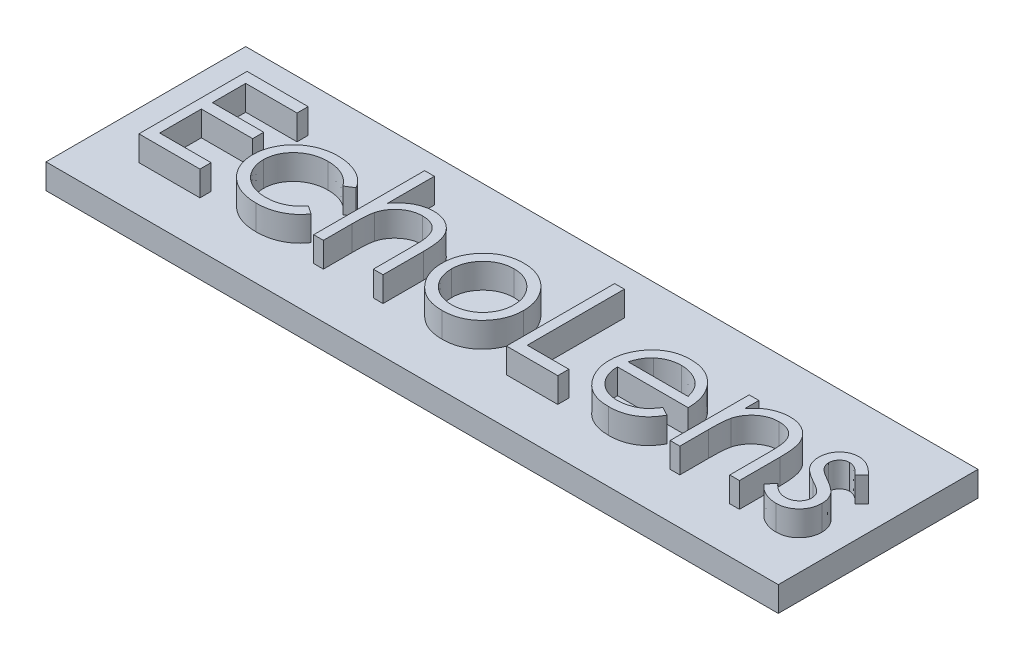
from build123d import *

# Parameters (mm, degrees)
SKETCH1_W           = 44
SKETCH1_H           = 12
BOSS_EXTRUDE1_DEPTH = 1.5
BOSS_EXTRUDE2_DEPTH = 1.5


with BuildPart() as part:
    # Sketch1 → Boss-Extrude1 (new body)
    with BuildSketch(Plane(origin=(0, 0, 0), x_dir=(1, 0, 0), z_dir=(0, 1, 0))):
        with Locations((0, 3.25)):
            Rectangle(SKETCH1_W, SKETCH1_H)
    extrude(amount=-BOSS_EXTRUDE1_DEPTH)

    # Sketch1<3> → Boss-Extrude2 (add)
    # profile 1 of 8: a face of its own
    with BuildSketch(Plane(origin=(0, 0, 0), x_dir=(1, 0, 0), z_dir=(0, 1, 0))):
        Polygon((-19.166666667, 6.5), (-19.166666667, 0), (-15.5, 0), (-15.5, 0.666666667), (-18.583333333, 0.666666667), (-18.583333333, 3.166666667), (-15.5, 3.166666667), (-15.5, 3.833333333), (-18.583333333, 3.833333333), (-18.583333333, 5.833333333), (-15.5, 5.833333333), (-15.5, 6.5), align=None)
    # profile 2 of 8: a face of its own
    with BuildSketch(Plane(origin=(0, 0, 0), x_dir=(1, 0, 0), z_dir=(0, 1, 0))):
        with BuildLine():
            add(Edge.make_bspline(
                [(17.833333333, 0.559895833), (17.91183066, 0.460355015), (18.0480398, 0.324779174), (18.258344258, 0.176966096), (18.431067874, 0.083741455), (18.613801438, 0.010099076), (18.865554121, -0.061803994), (19.060923375, -0.084323226), (19.19140625, -0.083333333)],
                knots=[0.350515196, 0.350515196, 0.350515196, 0.350515196, 0.595114129, 0.719056958, 0.845821647, 0.973296508, 1.098791235, 1.350515196, 1.350515196, 1.350515196, 1.350515196], degree=3))
            add(Edge.make_bspline(
                [(19.19140625, -0.083333333), (19.286843867, -0.08268315), (19.42853365, -0.072024247), (19.610519169, -0.029957184), (19.738593085, 0.014704012), (19.860286094, 0.070920807), (19.975872396, 0.138841981), (20.084526667, 0.22060146), (20.186382628, 0.313617655), (20.279409281, 0.415461478), (20.360891939, 0.523873955), (20.428763948, 0.63871253), (20.486686981, 0.757494075), (20.529541208, 0.883211445), (20.572246332, 1.059143612), (20.582456943, 1.196710606), (20.583333333, 1.2890625)],
                knots=[0.765180635, 0.765180635, 0.765180635, 0.765180635, 0.896540935, 0.959682152, 1.021612153, 1.082783528, 1.143809055, 1.205661307, 1.26947635, 1.333291392, 1.395143644, 1.455655936, 1.51654112, 1.576583297, 1.637981503, 1.765180635, 1.765180635, 1.765180635, 1.765180635], degree=3))
            add(Edge.make_bspline(
                [(20.361979167, 2.0234375), (20.432651307, 1.916588213), (20.551651176, 1.68137894), (20.581474324, 1.419515505), (20.583333333, 1.2890625)],
                knots=[0, 0, 0, 0, 0.495235025, 1, 1, 1, 1], degree=3))
            add(Edge.make_bspline(
                [(19.506510417, 2.690104167), (19.604418856, 2.636005318), (19.745289238, 2.554517104), (19.919274341, 2.437830938), (20.033423488, 2.354895977), (20.133557995, 2.271008369), (20.248135384, 2.166632696), (20.320816278, 2.081559281), (20.361979167, 2.0234375)],
                knots=[0, 0, 0, 0, 0.307114592, 0.446213159, 0.574876072, 0.69415211, 0.80458118, 1, 1, 1, 1], degree=3))
            add(Edge.make_bspline(
                [(18.828125, 3.1796875), (18.857806805, 3.139360593), (18.915766464, 3.08450984), (19.000408876, 3.009882962), (19.080798182, 2.950512124), (19.171367905, 2.888093733), (19.314083238, 2.80004431), (19.425869397, 2.732096268), (19.506510417, 2.690104167)],
                knots=[0, 0, 0, 0, 0.177559821, 0.28398236, 0.402216747, 0.53356848, 0.676120994, 1, 1, 1, 1], degree=3))
            add(Edge.make_bspline(
                [(18.666666667, 3.610677083), (18.66680691, 3.535712522), (18.69593832, 3.37944539), (18.778557506, 3.243812882), (18.828125, 3.1796875)],
                knots=[0, 0, 0, 0, 0.479403194, 1, 1, 1, 1], degree=3))
            add(Edge.make_bspline(
                [(19.283854167, 4.25), (19.202790293, 4.251661666), (19.08187837, 4.225488948), (18.938279167, 4.144579699), (18.845102024, 4.059333224), (18.766290259, 3.961312214), (18.688870494, 3.814869332), (18.666896009, 3.69228858), (18.666666667, 3.610677083)],
                knots=[0, 0, 0, 0, 0.245900629, 0.36916603, 0.498510841, 0.628503866, 0.751028329, 1, 1, 1, 1], degree=3))
            add(Edge.make_bspline(
                [(20.104166667, 3.75), (20.039505928, 3.827125335), (19.940206361, 3.934736043), (19.79567965, 4.053583252), (19.693465064, 4.125959487), (19.590465283, 4.180567938), (19.456634168, 4.233024102), (19.352224646, 4.249939149), (19.283854167, 4.25)],
                knots=[0, 0, 0, 0, 0.305035505, 0.441308964, 0.565963227, 0.683525114, 0.79333413, 1, 1, 1, 1], degree=3))
            Line((20.104166667, 3.75), (20.5, 4.157552083))
            add(Edge.make_bspline(
                [(19.283854167, 4.833333333), (19.385802566, 4.833234555), (19.541584834, 4.811522199), (19.741961467, 4.740076862), (19.894857727, 4.66546072), (20.046750564, 4.568700277), (20.257548697, 4.407355971), (20.406013609, 4.263956281), (20.5, 4.157552083)],
                knots=[0, 0, 0, 0, 0.213411613, 0.32612673, 0.444451672, 0.56906108, 0.702712204, 1, 1, 1, 1], degree=3))
            add(Edge.make_bspline(
                [(18.083333333, 3.587239583), (18.083921656, 3.67293245), (18.091588778, 3.800397203), (18.129996663, 3.963036276), (18.165358728, 4.078411359), (18.214548167, 4.187058988), (18.273317339, 4.290422632), (18.342380187, 4.388360811), (18.421946165, 4.479366681), (18.509429973, 4.562026598), (18.603948814, 4.634082151), (18.703377037, 4.695561875), (18.808135418, 4.747138801), (18.919231005, 4.786091835), (19.077416871, 4.822757633), (19.200444195, 4.834326094), (19.283854167, 4.833333333)],
                knots=[0, 0, 0, 0, 0.133043535, 0.196507438, 0.258613417, 0.319728338, 0.380872854, 0.442635602, 0.505079304, 0.56788052, 0.628813854, 0.688910091, 0.748765006, 0.809385783, 0.870884336, 1, 1, 1, 1], degree=3))
            add(Edge.make_bspline(
                [(18.30078125, 2.85546875), (18.227853533, 2.960201938), (18.119444929, 3.197727702), (18.080971468, 3.455904158), (18.083333333, 3.587239583)],
                knots=[0, 0, 0, 0, 0.492590796, 1, 1, 1, 1], degree=3))
            add(Edge.make_bspline(
                [(19.119791667, 2.20703125), (19.025830979, 2.258970114), (18.890284361, 2.336388916), (18.724868371, 2.450916827), (18.615091825, 2.530593062), (18.518274814, 2.611273959), (18.410720749, 2.715952529), (18.339668112, 2.797772412), (18.30078125, 2.85546875)],
                knots=[0, 0, 0, 0, 0.305950213, 0.443775499, 0.572824362, 0.692154156, 0.802295707, 1, 1, 1, 1], degree=3))
            add(Edge.make_bspline(
                [(19.83984375, 1.717447917), (19.808556469, 1.755087057), (19.750614644, 1.809702192), (19.66164666, 1.880439678), (19.577857698, 1.940524945), (19.481287293, 2.002900276), (19.327782958, 2.093166501), (19.205907181, 2.161611102), (19.119791667, 2.20703125)],
                knots=[0, 0, 0, 0, 0.167461676, 0.272270023, 0.389550841, 0.520801368, 0.666263293, 1, 1, 1, 1], degree=3))
            add(Edge.make_bspline(
                [(20, 1.264322917), (19.999689205, 1.345980779), (19.973704927, 1.509948366), (19.891638576, 1.6543966), (19.83984375, 1.717447917)],
                knots=[0, 0, 0, 0, 0.500453315, 1, 1, 1, 1], degree=3))
            add(Edge.make_bspline(
                [(19.161458333, 0.5), (19.271416434, 0.499048344), (19.434510065, 0.527438909), (19.630818421, 0.623588312), (19.757187173, 0.723910884), (19.86457304, 0.840859363), (19.968826893, 1.016027504), (20.000615188, 1.165488446), (20, 1.264322917)],
                knots=[0, 0, 0, 0, 0.261895674, 0.387836045, 0.517686206, 0.644508654, 0.764718263, 1, 1, 1, 1], degree=3))
            add(Edge.make_bspline(
                [(18.220052083, 1), (18.289973365, 0.922194824), (18.398232432, 0.813200055), (18.557669739, 0.695297675), (18.674340888, 0.623494147), (18.793613613, 0.568276989), (18.954185407, 0.516430618), (19.078896852, 0.499600367), (19.161458333, 0.5)],
                knots=[0, 0, 0, 0, 0.285904172, 0.417171648, 0.540500744, 0.659237718, 0.775006098, 1, 1, 1, 1], degree=3))
            Line((18.220052083, 1), (17.833333333, 0.559895833))
        make_face()
    # profile 3 of 8: a face of its own
    with BuildSketch(Plane(origin=(0, 0, 0), x_dir=(1, 0, 0), z_dir=(0, 1, 0))):
        with BuildLine():
            Line((12.75, 4.75), (12.75, 0))
            Line((12.75, 0), (13.333333333, 0))
            Line((13.333333333, 0), (13.333333333, 1.717447917))
            add(Edge.make_bspline(
                [(13.423177083, 2.9921875), (13.405802929, 2.9227345), (13.386418444, 2.808565672), (13.367154902, 2.643457372), (13.354035699, 2.493239674), (13.346051414, 2.324686359), (13.333883023, 2.064390259), (13.334203249, 1.859785879), (13.333333333, 1.717447917)],
                knots=[0, 0, 0, 0, 0.167615077, 0.271052394, 0.389459503, 0.520842802, 0.666398759, 1, 1, 1, 1], degree=3))
            add(Edge.make_bspline(
                [(15.0390625, 4.25), (14.946251525, 4.250444136), (14.807460208, 4.239868004), (14.627990648, 4.201070732), (14.497211345, 4.162358965), (14.371839436, 4.109117079), (14.247848685, 4.048708631), (14.129907546, 3.973403915), (14.01550118, 3.889478736), (13.909063342, 3.796474368), (13.810024154, 3.698334798), (13.721742348, 3.593822162), (13.641746323, 3.484625184), (13.572742802, 3.369226705), (13.491917097, 3.208152857), (13.446557215, 3.079950218), (13.423177083, 2.9921875)],
                knots=[0, 0, 0, 0, 0.126626858, 0.188984372, 0.250230194, 0.312351163, 0.374573618, 0.438147531, 0.502920413, 0.567974095, 0.630771334, 0.692934609, 0.754397534, 0.815218352, 0.876116925, 1, 1, 1, 1], degree=3))
            add(Edge.make_bspline(
                [(16.264322917, 3.315104167), (16.2317815, 3.457745072), (16.158097518, 3.661331633), (15.994174913, 3.887118341), (15.849599912, 4.021196413), (15.680155292, 4.125420764), (15.411945439, 4.226122324), (15.190700752, 4.25086197), (15.0390625, 4.25)],
                knots=[0, 0, 0, 0, 0.260833163, 0.378476029, 0.493177646, 0.609280965, 0.729981038, 1, 1, 1, 1], degree=3))
            add(Edge.make_bspline(
                [(16.333333333, 2.234375), (16.332414843, 2.358066375), (16.332208015, 2.53522146), (16.324905134, 2.760479809), (16.317580817, 2.904220143), (16.306813315, 3.030932352), (16.293160102, 3.166497337), (16.277439239, 3.25928602), (16.264322917, 3.315104167)],
                knots=[0, 0, 0, 0, 0.342109649, 0.489825663, 0.623254428, 0.740079676, 0.841482673, 1, 1, 1, 1], degree=3))
            Line((16.333333333, 2.234375), (16.333333333, 0))
            Line((16.333333333, 0), (16.916666667, 0))
            Line((16.916666667, 0), (16.916666667, 2.42578125))
            add(Edge.make_bspline(
                [(15.140625, 4.833333333), (15.31217977, 4.832197179), (15.568235459, 4.804335442), (15.885011659, 4.68779637), (16.101581369, 4.570503901), (16.296820124, 4.424493645), (16.46827991, 4.254427655), (16.61009753, 4.058801614), (16.705178352, 3.87731622), (16.767811596, 3.716322678), (16.807243466, 3.578435872), (16.840727915, 3.424816444), (16.869765406, 3.255928637), (16.889378626, 3.070589139), (16.910982338, 2.792525495), (16.91811515, 2.575627984), (16.916666667, 2.42578125)],
                knots=[0, 0, 0, 0, 0.15117814, 0.223487984, 0.295542644, 0.366976255, 0.437130525, 0.507043616, 0.578559734, 0.616613545, 0.658756237, 0.704491226, 0.754803115, 0.809331625, 0.868274455, 1, 1, 1, 1], degree=3))
            add(Edge.make_bspline(
                [(13.333333333, 3.893229167), (13.45099597, 4.045899796), (13.638371986, 4.259323773), (13.930535916, 4.483222438), (14.153342073, 4.613473968), (14.386652113, 4.711514848), (14.712584266, 4.807325961), (14.968932741, 4.832448887), (15.140625, 4.833333333)],
                knots=[0, 0, 0, 0, 0.273568781, 0.398988314, 0.519929781, 0.638110022, 0.756588901, 1, 1, 1, 1], degree=3))
            Line((13.333333333, 3.893229167), (13.333333333, 4.75))
            Line((13.333333333, 4.75), (12.75, 4.75))
        make_face()
    # profile 4 of 8: a face of its own
    with BuildSketch(Plane(origin=(0, 0, 0), x_dir=(1, 0, 0), z_dir=(0, 1, 0))):
        with BuildLine():
            add(Edge.make_bspline(
                [(6.75, 2.361979167), (6.751698779, 2.207794263), (6.768003796, 1.977783764), (6.835011895, 1.679810497), (6.906280489, 1.464637514), (6.99460728, 1.254277208), (7.103167047, 1.050059992), (7.233030397, 0.853284747), (7.380197303, 0.664446742), (7.543670902, 0.487988004), (7.727192914, 0.335455298), (7.924980011, 0.205535622), (8.138073557, 0.098865743), (8.366892225, 0.017289492), (8.699751362, -0.062839454), (8.961463082, -0.083261122), (9.139322917, -0.083333333)],
                knots=[0.183293708, 0.183293708, 0.183293708, 0.183293708, 0.304374132, 0.363361986, 0.422483372, 0.481999661, 0.542174786, 0.603662437, 0.666742017, 0.729860193, 0.79199231, 0.853479961, 0.915158744, 0.97849701, 1.043664483, 1.183293708, 1.183293708, 1.183293708, 1.183293708], degree=3))
            add(Edge.make_bspline(
                [(9.139322917, -0.083333333), (9.299582816, -0.083312607), (9.535210568, -0.067240483), (9.836779502, -0.0053499), (10.045334137, 0.058495393), (10.241912368, 0.141622392), (10.428163954, 0.240266544), (10.604092187, 0.356039933), (10.770636312, 0.488355696), (10.928629013, 0.640170473), (11.127242798, 0.881157331), (11.256260352, 1.083578262), (11.333333333, 1.227864583)],
                knots=[0.736737234, 0.736737234, 0.736737234, 0.736737234, 0.914843086, 0.998064997, 1.078293803, 1.156745143, 1.23483405, 1.312137372, 1.39038245, 1.470863007, 1.555076468, 1.736737234, 1.736737234, 1.736737234, 1.736737234], degree=3))
            Line((11.333333333, 1.227864583), (10.815104167, 1.5))
            add(Edge.make_bspline(
                [(9.06640625, 0.5), (9.181909214, 0.499441314), (9.355173646, 0.513041285), (9.581463334, 0.560434795), (9.747233286, 0.608457309), (9.906150507, 0.667115594), (10.053321462, 0.737873689), (10.188668072, 0.816154381), (10.31517965, 0.905680474), (10.437847352, 1.015291507), (10.611486103, 1.209955237), (10.736129676, 1.376411816), (10.815104167, 1.5)],
                knots=[0, 0, 0, 0, 0.163878894, 0.24565874, 0.327725695, 0.408609961, 0.485749086, 0.559169056, 0.630268476, 0.705306028, 0.792064966, 1, 1, 1, 1], degree=3))
            add(Edge.make_bspline(
                [(7.333333333, 2.25), (7.33665525, 2.126971694), (7.353147322, 1.945238643), (7.409382593, 1.712699673), (7.467410443, 1.550974882), (7.537745855, 1.396961566), (7.623887749, 1.251803551), (7.726662022, 1.11616169), (7.841295239, 0.988822629), (7.968894195, 0.875424424), (8.103133549, 0.77392699), (8.245935954, 0.688864137), (8.396175009, 0.619798364), (8.553609234, 0.565809232), (8.776433069, 0.515542949), (8.949385535, 0.499350586), (9.06640625, 0.5)],
                knots=[0, 0, 0, 0, 0.134475588, 0.198391058, 0.260753477, 0.321829223, 0.383037238, 0.444653123, 0.507398011, 0.569825238, 0.630777641, 0.690928687, 0.750945133, 0.811049477, 0.872330853, 1, 1, 1, 1], degree=3))
            Line((7.333333333, 2.25), (11.583333333, 2.25))
            add(Edge.make_bspline(
                [(11.06640625, 3.8984375), (11.151624318, 3.789072542), (11.262883964, 3.611456953), (11.381018248, 3.35742577), (11.452289406, 3.155216836), (11.509879653, 2.943825042), (11.56671098, 2.642306536), (11.58038147, 2.408339334), (11.583333333, 2.25)],
                knots=[0, 0, 0, 0, 0.236254763, 0.356174434, 0.477249655, 0.601539871, 0.729618382, 1, 1, 1, 1], degree=3))
            add(Edge.make_bspline(
                [(9.153645833, 4.833333333), (9.344611194, 4.83413557), (9.626726536, 4.806500902), (9.984399367, 4.707535152), (10.232967437, 4.605233265), (10.466353673, 4.472982878), (10.760293285, 4.25185142), (10.952401555, 4.048234852), (11.06640625, 3.8984375)],
                knots=[0, 0, 0, 0, 0.259032841, 0.381879824, 0.502258444, 0.62275219, 0.744742632, 1, 1, 1, 1], degree=3))
            add(Edge.make_bspline(
                [(7.296875, 3.947916667), (7.409367826, 4.088547972), (7.592794066, 4.285185666), (7.880023777, 4.490887502), (8.105809677, 4.617246658), (8.347872342, 4.713135642), (8.694314961, 4.810625247), (8.968941441, 4.831107399), (9.153645833, 4.833333333)],
                knots=[0, 0, 0, 0, 0.253589335, 0.374643257, 0.495340042, 0.616324775, 0.739759335, 1, 1, 1, 1], degree=3))
            add(Edge.make_bspline(
                [(6.75, 2.361979167), (6.751770392, 2.506453185), (6.765283112, 2.722121068), (6.824019675, 3.001702246), (6.88372205, 3.203922245), (6.960940381, 3.399925566), (7.087546966, 3.655303204), (7.208565513, 3.833717565), (7.296875, 3.947916667)],
                knots=[0, 0, 0, 0, 0.2537679, 0.377428427, 0.500550841, 0.623295883, 0.746578332, 1, 1, 1, 1], degree=3))
        make_face()
        with BuildLine():
            Line((11, 2.833333333), (7.39453125, 2.833333333))
            add(Edge.make_bspline(
                [(7.959635417, 3.8046875), (7.894857012, 3.750119974), (7.807188032, 3.655624515), (7.701833254, 3.516748729), (7.628731087, 3.399717708), (7.561765707, 3.272259032), (7.47593185, 3.085393604), (7.425051918, 2.936092469), (7.39453125, 2.833333333)],
                knots=[0, 0, 0, 0, 0.222580497, 0.338499871, 0.458708565, 0.585535346, 0.717517743, 1, 1, 1, 1], degree=3))
            add(Edge.make_bspline(
                [(9.18359375, 4.25), (9.068589514, 4.25028254), (8.897669428, 4.237845805), (8.677891118, 4.190065891), (8.520576582, 4.141899653), (8.370875446, 4.077593166), (8.175838255, 3.976535656), (8.044166745, 3.875799383), (7.959635417, 3.8046875)],
                knots=[0, 0, 0, 0, 0.259141276, 0.384161763, 0.505991952, 0.629098089, 0.750669123, 1, 1, 1, 1], degree=3))
            add(Edge.make_bspline(
                [(11, 2.833333333), (10.963091516, 2.983280931), (10.889520102, 3.194848993), (10.754930385, 3.449110301), (10.640556918, 3.60806047), (10.510876323, 3.749205116), (10.361111504, 3.872557025), (10.193157519, 3.98289574), (10.007892026, 4.076066465), (9.811695814, 4.155231801), (9.537196207, 4.226854228), (9.325558216, 4.252118994), (9.18359375, 4.25)],
                knots=[0, 0, 0, 0, 0.185231261, 0.267500523, 0.344400382, 0.419594869, 0.496890627, 0.576637919, 0.660267852, 0.745386615, 0.830040327, 1, 1, 1, 1], degree=3))
        make_face(mode=Mode.SUBTRACT)
    # profile 5 of 8: a face of its own
    with BuildSketch(Plane(origin=(0, 0, 0), x_dir=(1, 0, 0), z_dir=(0, 1, 0))):
        Polygon((2.916666667, 6.5), (2.916666667, 0), (6, 0), (6, 0.666666667), (3.5, 0.666666667), (3.5, 6.5), align=None)
    # profile 6 of 8: a face of its own
    with BuildSketch(Plane(origin=(0, 0, 0), x_dir=(1, 0, 0), z_dir=(0, 1, 0))):
        with BuildLine():
            add(Edge.make_bspline(
                [(-3.333333333, 2.361979167), (-3.334274733, 2.203068249), (-3.312528803, 1.966986591), (-3.240784407, 1.661693123), (-3.165045238, 1.442812454), (-3.067784079, 1.231316085), (-2.949137314, 1.028125893), (-2.808228452, 0.832847279), (-2.648517268, 0.647114404), (-2.471954888, 0.47600517), (-2.280297881, 0.326392137), (-2.076408873, 0.198975275), (-1.858853374, 0.096267271), (-1.630003239, 0.01486786), (-1.302183209, -0.063056704), (-1.045863407, -0.082549447), (-0.872395833, -0.083333333)],
                knots=[0.179537829, 0.179537829, 0.179537829, 0.179537829, 0.302719478, 0.362572166, 0.422404022, 0.482054714, 0.542853292, 0.604607128, 0.668580197, 0.732624972, 0.794983295, 0.856824241, 0.918712817, 0.981213642, 1.044902637, 1.179537829, 1.179537829, 1.179537829, 1.179537829], degree=3))
            add(Edge.make_bspline(
                [(-0.872395833, -0.083333333), (-0.699774313, -0.082657397), (-0.444366476, -0.062828898), (-0.11740689, 0.014895946), (0.111144302, 0.096000109), (0.327768382, 0.198972082), (0.530482835, 0.326778507), (0.721984269, 0.475960937), (0.898509307, 0.64712639), (1.058230504, 0.832844191), (1.199136782, 1.028126695), (1.317784218, 1.231315877), (1.415045201, 1.442812509), (1.490784417, 1.661693109), (1.562528796, 1.966986601), (1.584274736, 2.203068244), (1.583333333, 2.361979167)],
                knots=[0.820924402, 0.820924402, 0.820924402, 0.820924402, 0.955058561, 1.018827866, 1.081407505, 1.143069931, 1.204702869, 1.267139825, 1.331265359, 1.395319097, 1.457150804, 1.518026048, 1.577751959, 1.637659262, 1.697587423, 1.820924402, 1.820924402, 1.820924402, 1.820924402], degree=3))
            add(Edge.make_bspline(
                [(0.932291667, 4.05078125), (1.038206399, 3.935010826), (1.180081088, 3.749410866), (1.332811402, 3.481312255), (1.424004684, 3.272906458), (1.495768713, 3.056769941), (1.564839538, 2.754168384), (1.582452326, 2.519719025), (1.583333333, 2.361979167)],
                knots=[0, 0, 0, 0, 0.253834363, 0.376505623, 0.498533686, 0.621367729, 0.744564745, 1, 1, 1, 1], degree=3))
            add(Edge.make_bspline(
                [(-0.872395833, 4.833333333), (-0.697656962, 4.83514338), (-0.43909407, 4.809949971), (-0.10829026, 4.727039739), (0.125330722, 4.643085902), (0.345178633, 4.530304935), (0.628140343, 4.349147463), (0.816854482, 4.176949231), (0.932291667, 4.05078125)],
                knots=[0, 0, 0, 0, 0.258332351, 0.382133976, 0.503804392, 0.624692987, 0.74687059, 1, 1, 1, 1], degree=3))
            add(Edge.make_bspline(
                [(-2.682291667, 4.046875), (-2.567856959, 4.174729661), (-2.377461803, 4.345291731), (-2.095171954, 4.530115354), (-1.872906612, 4.640673621), (-1.639473633, 4.727535258), (-1.307326194, 4.809892354), (-1.048020832, 4.834936708), (-0.872395833, 4.833333333)],
                knots=[0, 0, 0, 0, 0.252712986, 0.374819133, 0.496436426, 0.617910557, 0.741287617, 1, 1, 1, 1], degree=3))
            add(Edge.make_bspline(
                [(-3.333333333, 2.361979167), (-3.332415409, 2.51929179), (-3.314684123, 2.753277516), (-3.245945907, 3.055083452), (-3.17409172, 3.270383316), (-3.082073354, 3.477885092), (-2.931356415, 3.746711993), (-2.787059224, 3.930783332), (-2.682291667, 4.046875)],
                knots=[0, 0, 0, 0, 0.255237725, 0.378678596, 0.501087887, 0.622713679, 0.746240795, 1, 1, 1, 1], degree=3))
        make_face()
        with BuildLine():
            add(Edge.make_bspline(
                [(-0.875, 4.25), (-0.999395729, 4.249668154), (-1.184272934, 4.232871383), (-1.421922518, 4.175106726), (-1.591740611, 4.114619692), (-1.754488097, 4.036418906), (-1.910319805, 3.940393751), (-2.059694325, 3.827788401), (-2.199689674, 3.698786654), (-2.328170769, 3.557868432), (-2.440488252, 3.40772148), (-2.535987529, 3.250781207), (-2.615564352, 3.08688391), (-2.674758375, 2.914370689), (-2.733146944, 2.672588199), (-2.749651087, 2.484593598), (-2.75, 2.358072917)],
                knots=[0, 0, 0, 0, 0.126043628, 0.187165358, 0.24739929, 0.308380031, 0.369779617, 0.432583925, 0.497640786, 0.562401137, 0.625557103, 0.687332005, 0.748312746, 0.809791039, 0.871767572, 1, 1, 1, 1], degree=3))
            add(Edge.make_bspline(
                [(1, 2.358072917), (0.999660268, 2.484599356), (0.983129326, 2.67257715), (0.924783766, 2.914386614), (0.865470243, 3.086824885), (0.786239063, 3.251205558), (0.68889811, 3.407260687), (0.577039245, 3.558388558), (0.447007792, 3.698331118), (0.307158579, 3.82783871), (0.157723496, 3.940437346), (0.002122945, 4.035997124), (-0.160152039, 4.115287452), (-0.329990753, 4.174559034), (-0.566895995, 4.23327065), (-0.751107552, 4.249349138), (-0.875, 4.25)],
                knots=[0, 0, 0, 0, 0.128273727, 0.19027022, 0.251768314, 0.312768695, 0.374793279, 0.437969586, 0.5030474, 0.568125214, 0.630949749, 0.692369109, 0.752973168, 0.813641067, 0.874355209, 1, 1, 1, 1], degree=3))
            add(Edge.make_bspline(
                [(-0.875, 0.5), (-0.709221792, 0.49834099), (-0.462974796, 0.528749791), (-0.150945942, 0.629581963), (0.068626402, 0.733306431), (0.272106752, 0.865221586), (0.456614421, 1.022022784), (0.615853592, 1.206650728), (0.752076148, 1.411972278), (0.86254442, 1.633496363), (0.970366299, 1.945894885), (0.999710484, 2.193304308), (1, 2.358072917)],
                knots=[0, 0, 0, 0, 0.168983264, 0.250907582, 0.333708096, 0.416004984, 0.497659568, 0.579893286, 0.663902321, 0.748466254, 0.831790886, 1, 1, 1, 1], degree=3))
            add(Edge.make_bspline(
                [(-2.75, 2.358072917), (-2.749592692, 2.193359231), (-2.720598115, 1.945786795), (-2.612261501, 1.633839975), (-2.503572671, 1.411700244), (-2.367215828, 1.206165341), (-2.206605135, 1.022916072), (-2.023414918, 0.864723284), (-1.819842231, 0.733422938), (-1.600040315, 0.629261288), (-1.287298782, 0.529211672), (-1.040850525, 0.498128783), (-0.875, 0.5)],
                knots=[0, 0, 0, 0, 0.168178654, 0.251488198, 0.335840671, 0.419834494, 0.502344876, 0.58364902, 0.665931005, 0.748716525, 0.831047336, 1, 1, 1, 1], degree=3))
        make_face(mode=Mode.SUBTRACT)
    # profile 7 of 8: a face of its own
    with BuildSketch(Plane(origin=(0, 0, 0), x_dir=(1, 0, 0), z_dir=(0, 1, 0))):
        with BuildLine():
            Line((-8.666666667, 6.666666667), (-8.666666667, 0))
            Line((-8.666666667, 0), (-8.083333333, 0))
            Line((-8.083333333, 0), (-8.083333333, 1.717447917))
            add(Edge.make_bspline(
                [(-7.993489583, 2.9921875), (-8.010861859, 2.923615594), (-8.030427756, 2.810334103), (-8.049492455, 2.646058774), (-8.062633597, 2.495844567), (-8.070650147, 2.326857741), (-8.082739272, 2.065690162), (-8.082501169, 1.860220964), (-8.083333333, 1.717447917)],
                knots=[0, 0, 0, 0, 0.165611346, 0.269045027, 0.387447975, 0.518826658, 0.665393555, 1, 1, 1, 1], degree=3))
            add(Edge.make_bspline(
                [(-6.37890625, 4.25), (-6.471719714, 4.250449092), (-6.61050368, 4.239858323), (-6.78998522, 4.201084903), (-6.92073108, 4.162306552), (-7.045871584, 4.109467169), (-7.169052687, 4.048314322), (-7.286784794, 3.973455241), (-7.401158512, 3.889464791), (-7.507605126, 3.796477968), (-7.606642042, 3.698333858), (-7.694924442, 3.59382241), (-7.774920311, 3.484625118), (-7.843923873, 3.369226722), (-7.924749563, 3.208152845), (-7.970109454, 3.079950224), (-7.993489583, 2.9921875)],
                knots=[0, 0, 0, 0, 0.126693877, 0.189084395, 0.250362632, 0.312516479, 0.374242602, 0.437850162, 0.502657326, 0.567745439, 0.630575914, 0.69277209, 0.754267546, 0.815120554, 0.876051359, 1, 1, 1, 1], degree=3))
            add(Edge.make_bspline(
                [(-5.151041667, 3.315104167), (-5.187060155, 3.45747234), (-5.262420861, 3.660662354), (-5.426323876, 3.887189682), (-5.57081728, 4.020778692), (-5.739012306, 4.125453603), (-6.006356775, 4.226484388), (-6.227310031, 4.250683293), (-6.37890625, 4.25)],
                knots=[0, 0, 0, 0, 0.26195405, 0.379637675, 0.494379033, 0.609866212, 0.729887486, 1, 1, 1, 1], degree=3))
            add(Edge.make_bspline(
                [(-5.083333333, 2.234375), (-5.084170681, 2.35807265), (-5.08459974, 2.535210551), (-5.091587322, 2.760493279), (-5.099638804, 2.904143836), (-5.108154816, 3.03099656), (-5.122396711, 3.166482473), (-5.137852972, 3.259291616), (-5.151041667, 3.315104167)],
                knots=[0, 0, 0, 0, 0.342141307, 0.489870991, 0.623312103, 0.740055623, 0.841468004, 1, 1, 1, 1], degree=3))
            Line((-5.083333333, 2.234375), (-5.083333333, 0))
            Line((-5.083333333, 0), (-4.5, 0))
            Line((-4.5, 0), (-4.5, 2.42578125))
            add(Edge.make_bspline(
                [(-6.276041667, 4.833333333), (-6.104493617, 4.832190639), (-5.848418482, 4.804347827), (-5.531673175, 4.687778689), (-5.315017618, 4.570569769), (-5.120340651, 4.424436334), (-4.947906032, 4.25575622), (-4.807058672, 4.060245635), (-4.711231736, 3.879627343), (-4.648881222, 3.718912447), (-4.609413163, 3.581044654), (-4.575950577, 3.427418241), (-4.546786891, 3.258112301), (-4.527384355, 3.07231417), (-4.505601491, 2.793400351), (-4.498553382, 2.576058884), (-4.5, 2.42578125)],
                knots=[0, 0, 0, 0, 0.151154907, 0.223453638, 0.295497225, 0.366919857, 0.436794085, 0.506696431, 0.577863847, 0.61591181, 0.658048026, 0.703775986, 0.754080143, 0.808979421, 0.867913193, 1, 1, 1, 1], degree=3))
            add(Edge.make_bspline(
                [(-8.083333333, 3.852864583), (-7.966027828, 4.008858008), (-7.771630092, 4.219134434), (-7.482791953, 4.454633128), (-7.259338085, 4.591916898), (-7.027082908, 4.700160733), (-6.702495071, 4.803870161), (-6.44682356, 4.832980631), (-6.276041667, 4.833333333)],
                knots=[0, 0, 0, 0, 0.273995891, 0.40068416, 0.522554679, 0.641533771, 0.759969143, 1, 1, 1, 1], degree=3))
            Line((-8.083333333, 3.852864583), (-8.083333333, 6.666666667))
            Line((-8.083333333, 6.666666667), (-8.666666667, 6.666666667))
        make_face()
    # profile 8 of 8: a face of its own
    with BuildSketch(Plane(origin=(0, 0, 0), x_dir=(1, 0, 0), z_dir=(0, 1, 0))):
        with BuildLine():
            add(Edge.make_bspline(
                [(-14.666666667, 2.3359375), (-14.66720001, 2.172979512), (-14.64378439, 1.931777416), (-14.566908936, 1.621061361), (-14.484087654, 1.401053735), (-14.379899803, 1.189693324), (-14.250194028, 0.989788476), (-14.100643479, 0.796924386), (-13.926478471, 0.618191634), (-13.736844013, 0.453346983), (-13.532491455, 0.308948999), (-13.315441333, 0.187578556), (-13.086412604, 0.088187441), (-12.845618009, 0.011093261), (-12.502869689, -0.062380257), (-12.236600433, -0.085161213), (-12.055989583, -0.083333333)],
                knots=[0.185130895, 0.185130895, 0.185130895, 0.185130895, 0.308146908, 0.367310494, 0.42644591, 0.485391052, 0.544963867, 0.606157649, 0.669460913, 0.733154405, 0.795739508, 0.858125904, 0.920680941, 0.984035129, 1.048795645, 1.185130895, 1.185130895, 1.185130895, 1.185130895], degree=3))
            add(Edge.make_bspline(
                [(-12.055989583, -0.083333333), (-11.936743985, -0.085165437), (-11.760028134, -0.073785492), (-11.528709677, -0.045050237), (-11.362263964, -0.013326591), (-11.201219614, 0.026499634), (-11.045257011, 0.076583317), (-10.894193352, 0.13488218), (-10.748684861, 0.20267935), (-10.608936592, 0.278103426), (-10.476392423, 0.361924844), (-10.349499948, 0.450793443), (-10.232337679, 0.54969612), (-10.120952045, 0.653934828), (-9.981528424, 0.803540247), (-9.88968329, 0.927231404), (-9.833333333, 1.013020833)],
                knots=[0.709401096, 0.709401096, 0.709401096, 0.709401096, 0.847574556, 0.914572325, 0.97963584, 1.04397871, 1.10686358, 1.169498105, 1.231659496, 1.29292779, 1.353545327, 1.413469107, 1.472444448, 1.531204549, 1.590332234, 1.709401096, 1.709401096, 1.709401096, 1.709401096], degree=3))
            Line((-9.833333333, 1.013020833), (-10.321614583, 1.333333333))
            add(Edge.make_bspline(
                [(-12.046875, 0.5), (-11.877860634, 0.500099486), (-11.627359727, 0.523655576), (-11.308843494, 0.61266578), (-11.085247592, 0.703832811), (-10.874028327, 0.821900617), (-10.605768893, 1.018762302), (-10.42790704, 1.19938865), (-10.321614583, 1.333333333)],
                knots=[0, 0, 0, 0, 0.255447312, 0.377298345, 0.498441779, 0.619372125, 0.741856502, 1, 1, 1, 1], degree=3))
            add(Edge.make_bspline(
                [(-14.083333333, 2.388020833), (-14.08288075, 2.222992689), (-14.050580546, 1.974355569), (-13.93770351, 1.66019271), (-13.822586432, 1.434240458), (-13.676807201, 1.225136712), (-13.505639042, 1.037594406), (-13.308929941, 0.875257104), (-13.088426512, 0.740639083), (-12.849309504, 0.632539524), (-12.504026856, 0.527718532), (-12.230873457, 0.500701726), (-12.046875, 0.5)],
                knots=[0, 0, 0, 0, 0.159965477, 0.240321361, 0.322528528, 0.405023583, 0.486596636, 0.567865474, 0.651332773, 0.736237567, 0.821529069, 1, 1, 1, 1], degree=3))
            add(Edge.make_bspline(
                [(-12.05078125, 4.25), (-12.19084161, 4.247960598), (-12.39865763, 4.235741474), (-12.664485854, 4.176075586), (-12.852128341, 4.118258232), (-13.029896024, 4.040712936), (-13.19824742, 3.946354367), (-13.35867767, 3.836689358), (-13.50653743, 3.709641381), (-13.641790864, 3.571472371), (-13.758976141, 3.423358412), (-13.860996184, 3.269735629), (-13.941070874, 3.106768563), (-14.006504753, 2.938182775), (-14.065004702, 2.699041281), (-14.083962113, 2.513497756), (-14.083333333, 2.388020833)],
                knots=[0, 0, 0, 0, 0.136920982, 0.201969243, 0.26546155, 0.328247885, 0.390816717, 0.453550176, 0.517541982, 0.580738372, 0.641921509, 0.701596724, 0.76031288, 0.818756513, 0.87771808, 1, 1, 1, 1], degree=3))
            add(Edge.make_bspline(
                [(-10.321614583, 3.416666667), (-10.422434121, 3.551072755), (-10.594601354, 3.732455973), (-10.858635059, 3.928302747), (-11.068920252, 4.046700622), (-11.294372514, 4.138002927), (-11.620140997, 4.226432464), (-11.876973664, 4.250261667), (-12.05078125, 4.25)],
                knots=[0, 0, 0, 0, 0.252584475, 0.373506483, 0.493364451, 0.614608597, 0.738470244, 1, 1, 1, 1], degree=3))
            Line((-10.321614583, 3.416666667), (-9.833333333, 3.720052083))
            add(Edge.make_bspline(
                [(-12.0078125, 4.833333333), (-11.852573103, 4.833817839), (-11.621127043, 4.814407804), (-11.317909508, 4.756056582), (-11.098491823, 4.691930615), (-10.88910625, 4.614162634), (-10.693110293, 4.526859418), (-10.515126583, 4.425465188), (-10.351814705, 4.314567141), (-10.202974805, 4.18943023), (-10.019024285, 3.999609023), (-9.901431955, 3.836778192), (-9.833333333, 3.720052083)],
                knots=[0, 0, 0, 0, 0.182081405, 0.271909655, 0.362049459, 0.450066348, 0.533976474, 0.613602454, 0.690197614, 0.765412877, 0.841436551, 1, 1, 1, 1], degree=3))
            add(Edge.make_bspline(
                [(-14.666666667, 2.3359375), (-14.668272285, 2.447572284), (-14.654015323, 2.613477607), (-14.621339763, 2.832185801), (-14.580500991, 2.991174648), (-14.533236396, 3.148297933), (-14.47292948, 3.301666773), (-14.402179595, 3.451992534), (-14.321854903, 3.598888334), (-14.231432852, 3.739937474), (-14.13136773, 3.873194281), (-14.025428242, 4.000259559), (-13.908658321, 4.116746544), (-13.786013249, 4.227313755), (-13.65402318, 4.329007419), (-13.51344517, 4.422126385), (-13.366390429, 4.508392621), (-13.212944531, 4.585202758), (-13.054035023, 4.65137968), (-12.89061931, 4.70793106), (-12.722436517, 4.752717646), (-12.550600938, 4.790215503), (-12.312183265, 4.822309979), (-12.130551964, 4.833976976), (-12.0078125, 4.833333333)],
                knots=[0, 0, 0, 0, 0.082135503, 0.122636035, 0.16283087, 0.203006601, 0.243526083, 0.284172936, 0.325409811, 0.366854666, 0.407550595, 0.448187374, 0.488682851, 0.529014965, 0.569842729, 0.611370238, 0.653237735, 0.695446119, 0.737751395, 0.780043361, 0.82280707, 0.865978142, 0.90959503, 1, 1, 1, 1], degree=3))
        make_face()
    extrude(amount=BOSS_EXTRUDE2_DEPTH)


solid = part.part
